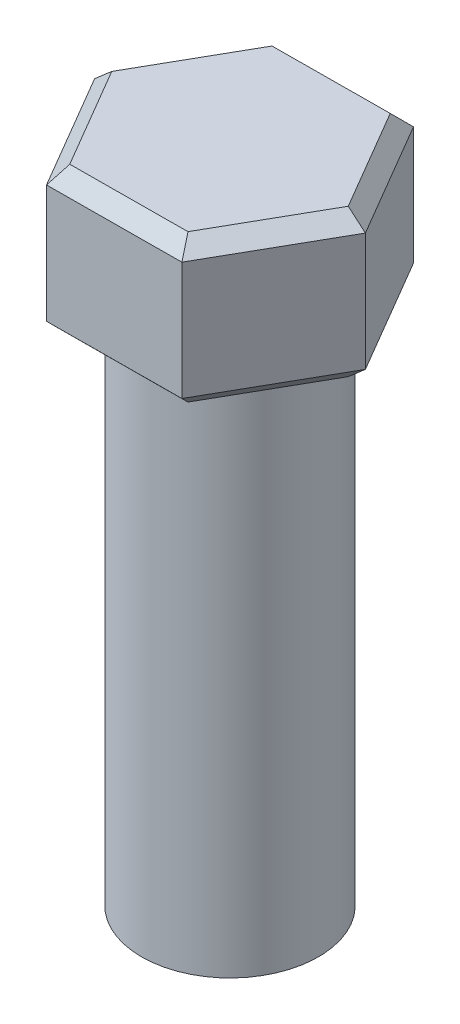
from build123d import *

# Parameters (mm, degrees)
CROQUIS2_R              = 6
SALIENTE_EXTRUIR1_DEPTH = 35
SALIENTE_EXTRUIR2_DEPTH = 10
CHAFL_N1_SIZE           = 1


with BuildPart() as part:
    # Croquis2 → Saliente-Extruir1 (new body)
    with BuildSketch(Plane(origin=(0, 0, 0), x_dir=(1, 0, 0), z_dir=(0, 1, 0))):
        with Locations(Location((0, 0, 0), (0, 0, 270))):
            Circle(CROQUIS2_R)
    extrude(amount=SALIENTE_EXTRUIR1_DEPTH)

    # Croquis3 → Saliente-Extruir2 (add)
    with BuildSketch(Plane(origin=(0, 35, 0), x_dir=(1, 0, 0), z_dir=(0, 1, 0))):
        Polygon((4.607833062, -7.866269978), (9.116306165, 0.057365499), (4.508473103, 7.923635477), (-4.607833062, 7.866269978), (-9.116306165, -0.057365499), (-4.508473103, -7.923635477), align=None)
    extrude(amount=SALIENTE_EXTRUIR2_DEPTH)

    # Chaflán1
    chafl_n1_edges = [part.edges().sort_by_distance(p)[0] for p in [
        (0.04967998, 35, 7.894952727),
        (6.862069613, 35, 3.904452239),
        (6.812389634, 35, -3.990500488),
        (-0.04967998, 35, -7.894952727),
        (-6.862069613, 35, -3.904452239),
        (-6.812389634, 35, 3.990500488),
        (0.04967998, 45, 7.894952727),
        (6.862069613, 45, 3.904452239),
        (6.812389634, 45, -3.990500488),
        (-0.04967998, 45, -7.894952727),
        (-6.862069613, 45, -3.904452239),
        (-6.812389634, 45, 3.990500488),
    ]]
    chamfer(chafl_n1_edges, length=CHAFL_N1_SIZE)


solid = part.part
